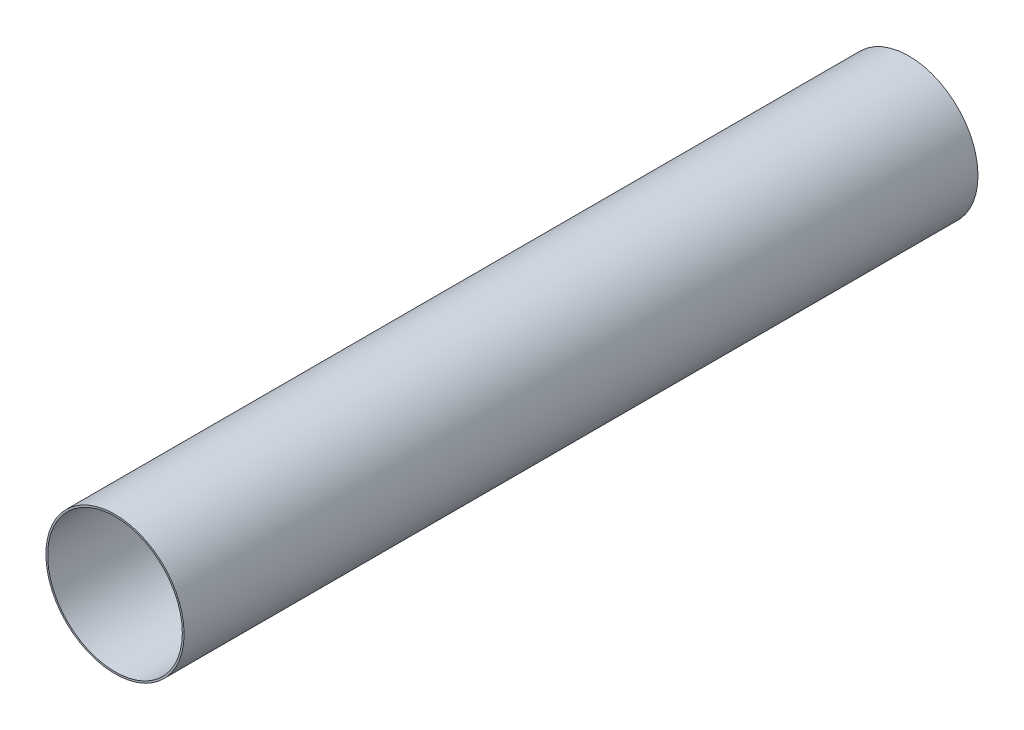
from build123d import *

# Parameters (mm, degrees)
SKETCH1_R           = 78.35
SKETCH1_R_2         = 76.35
BOSS_EXTRUDE1_DEPTH = 900


with BuildPart() as part:
    # Sketch1 → Boss-Extrude1 (new body)
    with BuildSketch(Plane.XY):
        Circle(SKETCH1_R)
        Circle(SKETCH1_R_2, mode=Mode.SUBTRACT)
    extrude(amount=BOSS_EXTRUDE1_DEPTH)


solid = part.part
